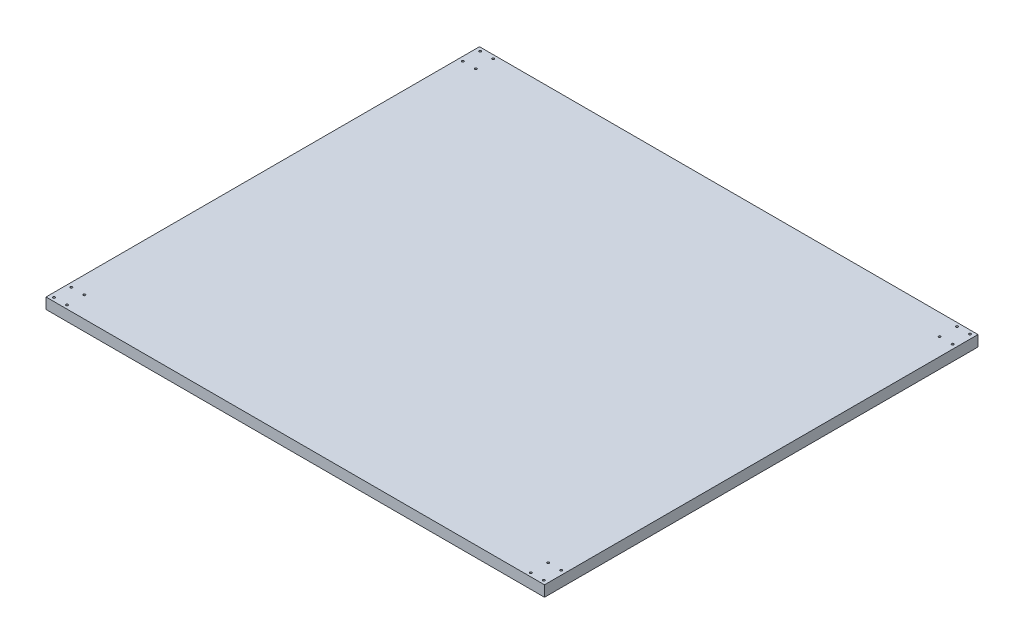
from build123d import *

# Parameters (mm, degrees)
CROQUIS1_W              = 690
CROQUIS1_H              = 600
SALIENTE_EXTRUIR1_DEPTH = 15
CROQUIS3_R              = 1.5
CORTAR_EXTRUIR1_DEPTH   = 458.438520459


with BuildPart() as part:
    # Croquis1 → Saliente-Extruir1 (new body)
    with BuildSketch(Plane(origin=(0, 0, 0), x_dir=(1, 0, 0), z_dir=(0, 1, 0))):
        Rectangle(CROQUIS1_W, CROQUIS1_H)
    extrude(amount=SALIENTE_EXTRUIR1_DEPTH)

    # Croquis3 → Cortar-Extruir1 (cut, through all)
    with BuildSketch(Plane(origin=(0, 15, 0), x_dir=(1, 0, 0), z_dir=(0, 1, 0))):
        with Locations(Location((339, -295, 0), (0, 0, 270))):
            Circle(CROQUIS3_R)
        with Locations(Location((321, -295, 0), (0, 0, 270))):
            Circle(CROQUIS3_R)
        with Locations(Location((321, -271, 0), (0, 0, 270))):
            Circle(CROQUIS3_R)
        with Locations(Location((339, -271, 0), (0, 0, 270))):
            Circle(CROQUIS3_R)
        with Locations(Location((-321, -295, 0), (0, 0, 90))):
            Circle(CROQUIS3_R)
        with Locations(Location((-339, -295, 0), (0, 0, 90))):
            Circle(CROQUIS3_R)
        with Locations(Location((-339, -271, 0), (0, 0, 90))):
            Circle(CROQUIS3_R)
        with Locations(Location((-321, -271, 0), (0, 0, 90))):
            Circle(CROQUIS3_R)
        with Locations(Location((-321, 295, 0), (0, 0, 270))):
            Circle(CROQUIS3_R)
        with Locations(Location((-339, 295, 0), (0, 0, 270))):
            Circle(CROQUIS3_R)
        with Locations(Location((-339, 271, 0), (0, 0, 270))):
            Circle(CROQUIS3_R)
        with Locations(Location((-321, 271, 0), (0, 0, 270))):
            Circle(CROQUIS3_R)
        with Locations(Location((321, 295, 0), (0, 0, 90))):
            Circle(CROQUIS3_R)
        with Locations(Location((339, 295, 0), (0, 0, 90))):
            Circle(CROQUIS3_R)
        with Locations(Location((339, 271, 0), (0, 0, 90))):
            Circle(CROQUIS3_R)
        with Locations(Location((321, 271, 0), (0, 0, 90))):
            Circle(CROQUIS3_R)
    extrude(amount=-CORTAR_EXTRUIR1_DEPTH, mode=Mode.SUBTRACT)


solid = part.part
